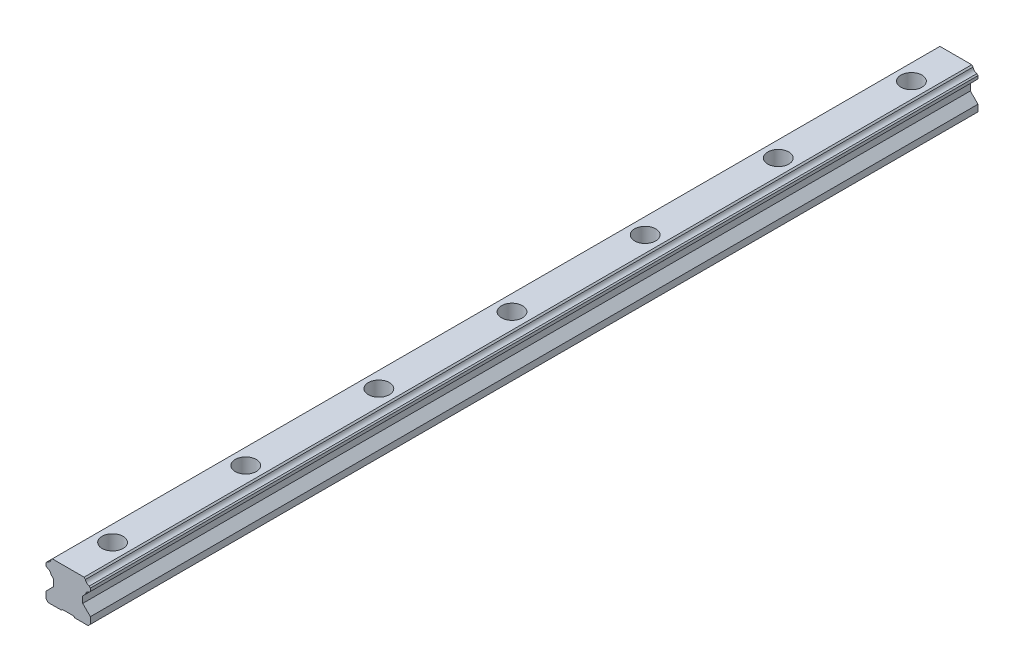
from build123d import *

# Parameters (mm, degrees)
BOSS_EXTRUDE1_DEPTH = 200
LPATTERN1_COUNT     = 7
LPATTERN1_PITCH     = 60


with BuildPart() as part:
    # Sketch1 → Boss-Extrude1 (new, symmetric)
    with BuildSketch(Plane.XY):
        with BuildLine():
            Line((-10, -10.494534492), (-10, -13.49461174))
            Line((-10, -13.49461174), (-9, -14.49461174))
            Line((-9, -14.49461174), (-3, -14.49461174))
            Line((-3, -14.49461174), (-2.5, -13.99461174))
            Line((-2.5, -13.99461174), (2.5, -13.99461174))
            Line((2.5, -13.99461174), (3, -14.49461174))
            Line((3, -14.49461174), (9, -14.49461174))
            Line((9, -14.49461174), (10, -13.49461174))
            Line((10, -13.49461174), (10, -10.494534492))
            Line((10, -10.494534492), (6.550048828, -7.044660568))
            Line((6.550048828, -7.044660568), (6.550048828, -4.115376472))
            Line((6.550048828, -4.115376472), (7.767930373, -2.899480236))
            ThreePointArc((7.767930373, -2.899480236), (8.341068744, -1.762979997), (9.472673258, -1.180235103))
            Line((9.472673258, -1.180235103), (10, -0.665425301))
            Line((10, -0.665425301), (10, 0.665425301))
            Line((10, 0.665425301), (9.472673258, 1.192752043))
            ThreePointArc((9.472673258, 1.192752043), (8.344874488, 1.769695527), (7.767930373, 2.897493974))
            Line((7.767930373, 2.897493974), (7.160036564, 3.50538826))
            Line((7.160036564, 3.50538826), (-7.160036564, 3.50538826))
            Line((-7.160036564, 3.50538826), (-7.767930373, 2.897493974))
            ThreePointArc((-7.767930373, 2.897493974), (-8.344874488, 1.769695527), (-9.472673258, 1.192752043))
            Line((-9.472673258, 1.192752043), (-10, 0.665425301))
            Line((-10, 0.665425301), (-10, -0.665425301))
            Line((-10, -0.665425301), (-9.472673258, -1.180235103))
            ThreePointArc((-9.472673258, -1.180235103), (-8.341068744, -1.762979997), (-7.767930373, -2.899480236))
            Line((-7.767930373, -2.899480236), (-6.550048828, -4.115376472))
            Line((-6.550048828, -4.115376472), (-6.550048828, -7.044660568))
            Line((-6.550048828, -7.044660568), (-10, -10.494534492))
        make_face()
    extrude(amount=BOSS_EXTRUDE1_DEPTH, both=True)

    # Sketch2 → Cut-Revolve1 (revolve, cut)
    with BuildSketch(Plane(origin=(0, 0, 0), x_dir=(0, 0, -1), z_dir=(1, 0, 0))):
        Polygon((-180, 3.50538826), (-180, -14.49461174), (-183, -14.49461174), (-183, -4.99461174), (-184.75, -4.99461174), (-184.75, 3.50538826), align=None)
    cut_revolve1 = revolve(axis=Axis((0, 3.50538826, 180), (0, -1, 0)), mode=Mode.SUBTRACT)

    # LPattern1: Cut-Revolve1 ×7
    with Locations(*[(0, 0, -i * LPATTERN1_PITCH) for i in range(1, LPATTERN1_COUNT)]):
        add(cut_revolve1, mode=Mode.SUBTRACT)


solid = part.part
